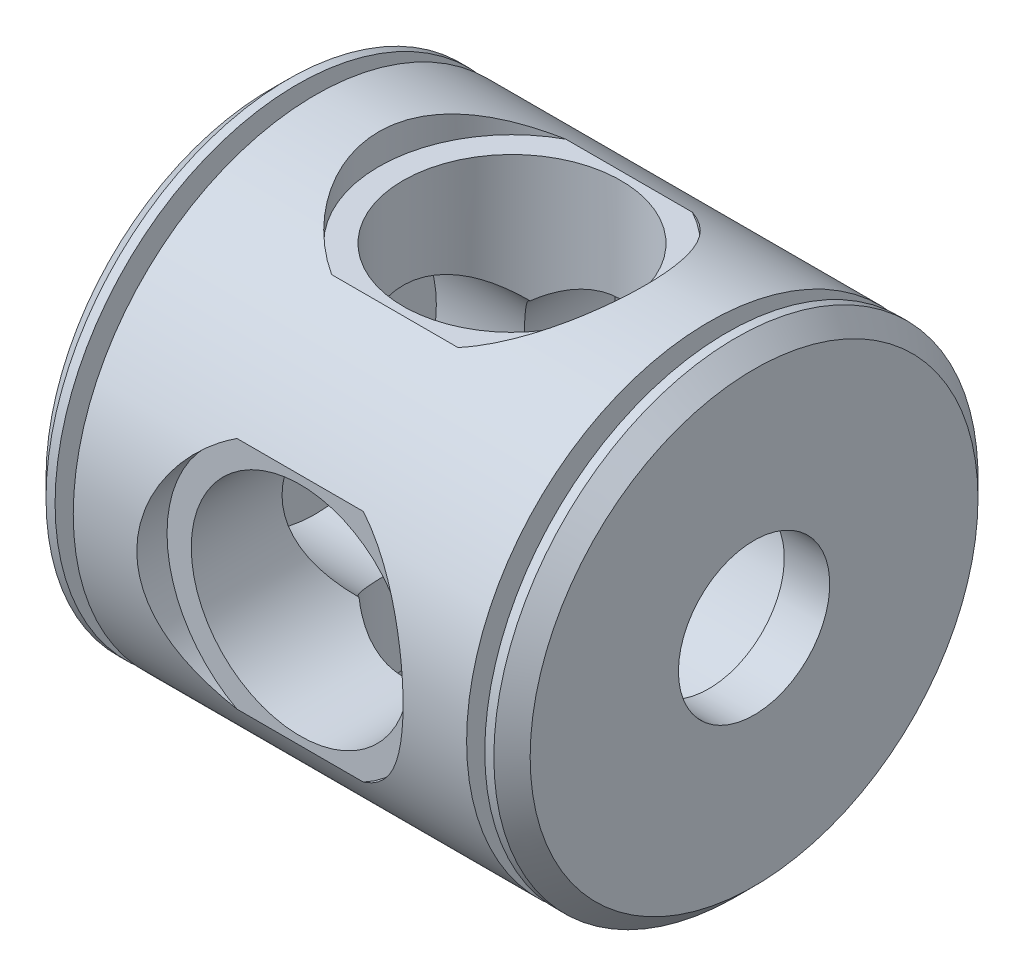
from build123d import *

# Parameters (mm, degrees)
CHAMFER1_SIZE            = 3
CHAMFER1_OF_MIRROR1_SIZE = 3
SKETCH3_R                = 22
CUT_EXTRUDE1_DEPTH       = 5
CUT_EXTRUDE3_REACH       = 95.941
CUT_EXTRUDE3_END_RADIUS  = 20
SKETCH4_R                = 18
CIRPATTERN2_COUNT        = 4


with BuildPart() as part:
    # Sketch2 → Revolve1 (revolve)
    with BuildSketch(Plane.XY, mode=Mode.PRIVATE) as revolve1_sk:
        Polygon((32.5, 12.5), (40, 12.5), (40, 40), (35.5, 40), (35.5, 35), (32.5, 35), (32.5, 40), (0, 40), (0, 20), (32.5, 20), align=None)
    revolve1 = revolve(revolve1_sk.sketch.rotate(Axis((-15.710900474, 0, 0), (1, 0, 0)), 90), axis=Axis((-15.710900474, 0, 0), (1, 0, 0)))

    # Chamfer1
    chamfer1_edges = [part.edges().sort_by_distance(p)[0] for p in [
        (40, 0, -40),
    ]]
    chamfer(chamfer1_edges, length=CHAMFER1_SIZE)

    # Mirror1: Revolve1 across plane
    add(revolve1.mirror(Plane(origin=(0, 40, 0), x_dir=(0, 0, 1), z_dir=(1, 0, 0))))

    # Chamfer1 of Mirror1
    chamfer1_of_mirror1_edges = [part.edges().sort_by_distance(p)[0] for p in [
        (-40, 0, -40),
    ]]
    chamfer(chamfer1_of_mirror1_edges, length=CHAMFER1_OF_MIRROR1_SIZE)

    # Sketch3 → Cut-Extrude1 (cut)
    with BuildSketch(Plane(origin=(0, 0, -40), x_dir=(-1, 0, 0), z_dir=(0, 0, -1))):
        Circle(SKETCH3_R)
    cut_extrude1 = extrude(amount=-CUT_EXTRUDE1_DEPTH, mode=Mode.SUBTRACT)

    # Cut-Extrude3: up to this cylinder (the profile starts outside it)
    cut_extrude3_end = Plane(origin=(0, 0, 0), z_dir=(-1, 0, 0)) * Cylinder(CUT_EXTRUDE3_END_RADIUS, 232.882, mode=Mode.PRIVATE)
    # Sketch4 → Cut-Extrude3 (cut, up to the surface)
    with BuildSketch(Plane(origin=(0, 0, -35), x_dir=(-1, 0, 0), z_dir=(0, 0, -1)), mode=Mode.PRIVATE) as cut_extrude3_sk1:
        Circle(SKETCH4_R)
    cut_extrude3_tool1 = extrude(cut_extrude3_sk1.sketch, amount=-CUT_EXTRUDE3_REACH, mode=Mode.PRIVATE) - cut_extrude3_end
    cut_extrude3 = cut_extrude3_tool1.solids().sort_by_distance((0, 0, -35))[0]
    add(cut_extrude3, mode=Mode.SUBTRACT)

    # CirPattern2: Cut-Extrude1, Cut-Extrude3 ×4 about axis
    cirpattern2_axis = Axis((0, 0, 0), (1, 0, 0))
    add([cut_extrude1.rotate(cirpattern2_axis, i * 360 / CIRPATTERN2_COUNT) for i in range(1, CIRPATTERN2_COUNT)], mode=Mode.SUBTRACT)
    add([cut_extrude3.rotate(cirpattern2_axis, i * 360 / CIRPATTERN2_COUNT) for i in range(1, CIRPATTERN2_COUNT)], mode=Mode.SUBTRACT)


solid = part.part
